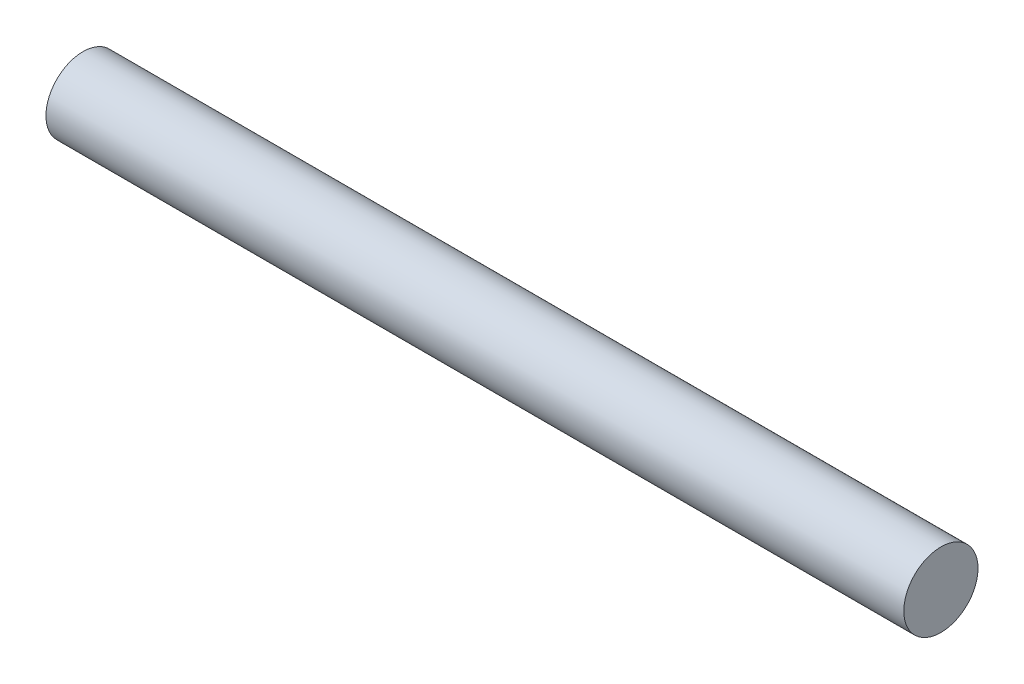
from build123d import *

# Parameters (mm, degrees)
SKETCH_1_R      = 1.6
EXTRUDE_1_DEPTH = 37


with BuildPart() as part:
    # 草图1 → 凸台-拉伸1 (new body)
    with BuildSketch(Plane(origin=(0, 0, 0), x_dir=(0, 0, -1), z_dir=(1, 0, 0))):
        Circle(SKETCH_1_R)
    extrude(amount=EXTRUDE_1_DEPTH)


solid = part.part
